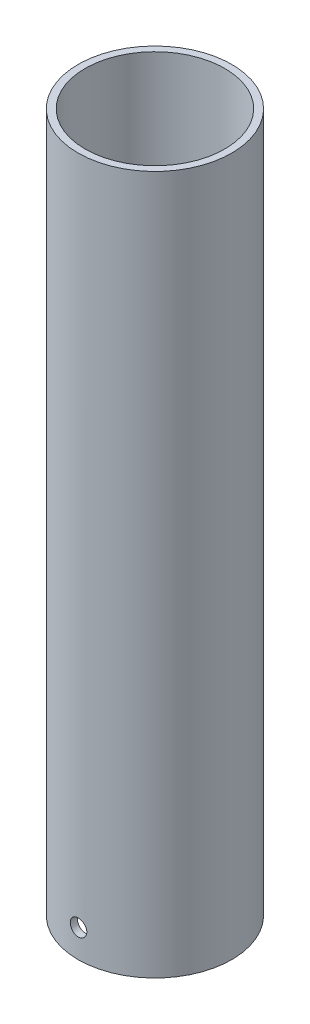
from build123d import *

# Parameters (mm, degrees)
SKETCH1_R               = 55
SKETCH1_R_2             = 50
BOSS_EXTRUDE2_DEPTH     = 500
G1_4_TAPPED_HOLE1_D     = 11.8
G1_4_TAPPED_HOLE1_DEPTH = 30.32
G1_4_TAPPED_HOLE1_TIP   = 3.545077652


with BuildPart() as part:
    # Sketch1 → Boss-Extrude2 (new body)
    with BuildSketch(Plane(origin=(0, 0, 0), x_dir=(1, 0, 0), z_dir=(0, 1, 0))):
        with Locations(Location((0, 0, 0), (0, 0, 270))):
            Circle(SKETCH1_R)
        with Locations(Location((0, 0, 0), (0, 0, 270))):
            Circle(SKETCH1_R_2, mode=Mode.SUBTRACT)
    extrude(amount=-BOSS_EXTRUDE2_DEPTH)

    # G1/4 Tapped Hole1
    with Locations(Plane.XY.offset(55)):
        with Locations((0, -480)):
            Hole(G1_4_TAPPED_HOLE1_D / 2, depth=G1_4_TAPPED_HOLE1_DEPTH)
            with Locations((0, 0, -(G1_4_TAPPED_HOLE1_DEPTH + G1_4_TAPPED_HOLE1_TIP / 2))):  # 118° drill point
                Cone(0, G1_4_TAPPED_HOLE1_D / 2, G1_4_TAPPED_HOLE1_TIP, mode=Mode.SUBTRACT)


solid = part.part
